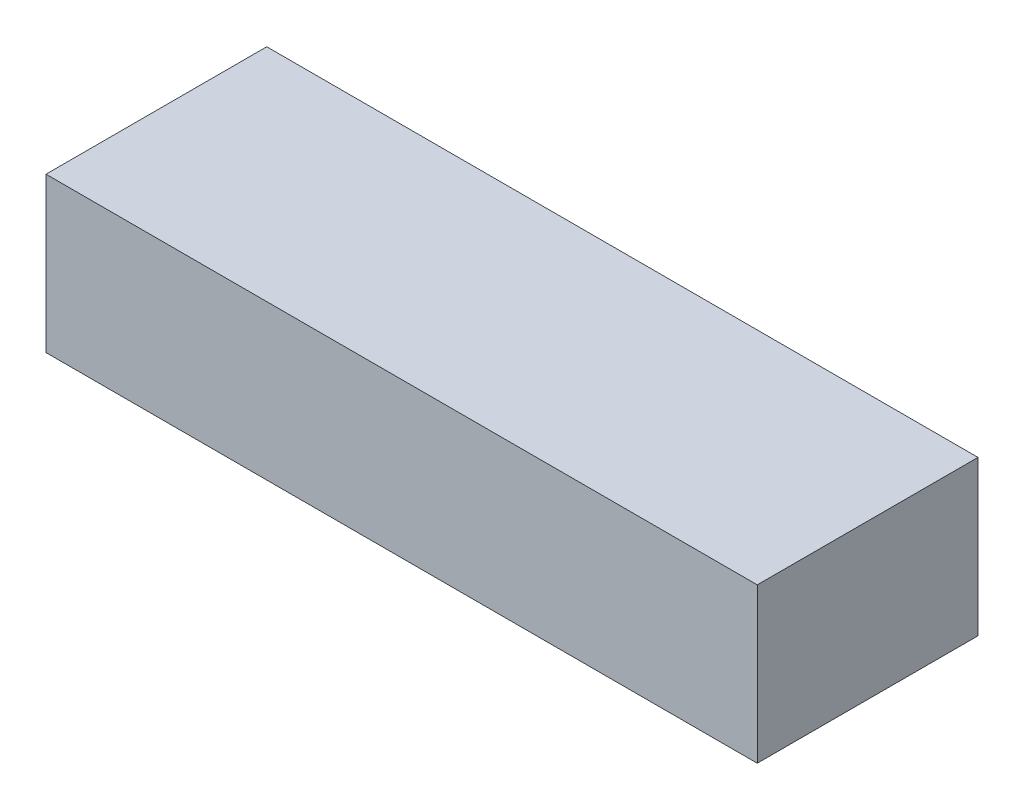
from build123d import *

# Parameters (mm, degrees)
SKETCH1_W           = 145
SKETCH1_H           = 45
BOSS_EXTRUDE1_DEPTH = 31.5


with BuildPart() as part:
    # Sketch1 → Boss-Extrude1 (new body)
    with BuildSketch(Plane(origin=(0, 0, 0), x_dir=(1, 0, 0), z_dir=(0, 1, 0))):
        Rectangle(SKETCH1_W, SKETCH1_H)
    extrude(amount=BOSS_EXTRUDE1_DEPTH)


solid = part.part
